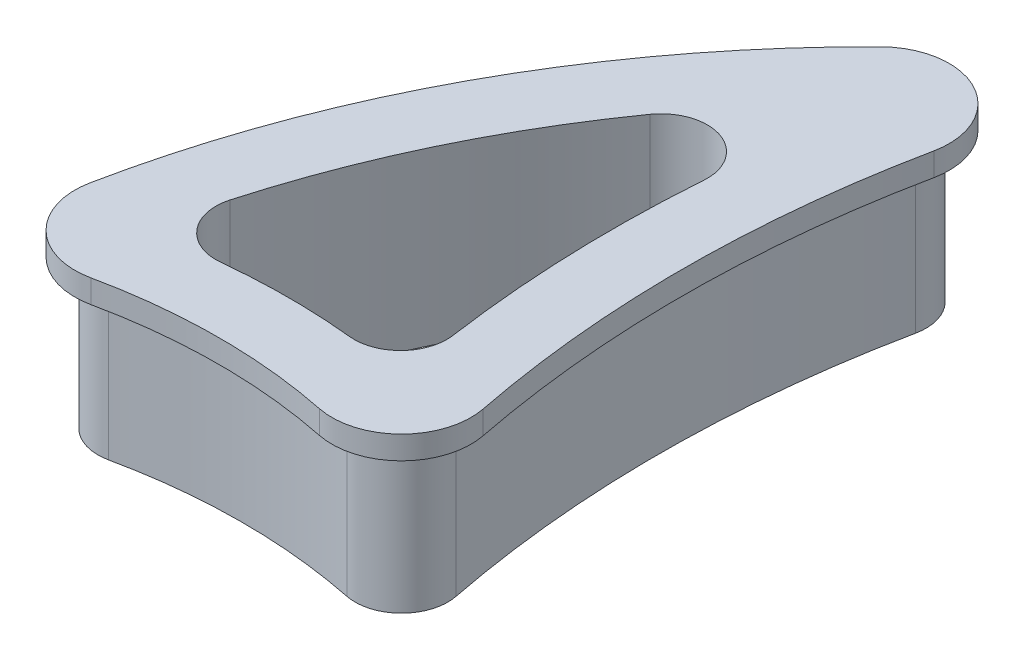
from build123d import *

# Parameters (mm, degrees)
EXTRUDE_1_DEPTH = 6.4
EXTRUDE_2_DEPTH = 1


with BuildPart() as part:
    # 草图1 → 凸台-拉伸1 (new body)
    with BuildSketch(Plane(origin=(0, 0, 0), x_dir=(1, 0, 0), z_dir=(0, 1, 0))):
        with BuildLine():
            ThreePointArc((2.829565104, -15.529906263), (1.88418981, -5.646325328), (2.910376158, 4.229192286))
            ThreePointArc((2.910376158, 4.229192286), (1.906294085, 6.389735523), (-0.452755984, 6.056552897))
            ThreePointArc((-0.452755984, 6.056552897), (-7.914394861, -3.882962322), (-12.140415639, -15.571023149))
            ThreePointArc((-12.140415639, -15.571023149), (-11.58539557, -17.387944), (-9.761966891, -17.92119489))
            ThreePointArc((-9.761966891, -17.92119489), (-4.64989516, -17.37013276), (0.466793237, -17.876538427))
            ThreePointArc((0.466793237, -17.876538427), (2.276755445, -17.336121852), (2.829565104, -15.529906263))
        make_face()
        with BuildLine():
            ThreePointArc((-3.602001562, -0.725023821), (-7.054850169, -6.602735021), (-9.459511378, -12.981391378))
            ThreePointArc((-9.459511378, -12.981391378), (-9.06507879, -14.812553198), (-7.328283633, -15.514175078))
            ThreePointArc((-7.328283633, -15.514175078), (-4.550929201, -15.369896432), (-1.773466789, -15.512081246))
            ThreePointArc((-1.773466789, -15.512081246), (-0.126352502, -14.908348224), (0.411230412, -13.238472884))
            ThreePointArc((0.411230412, -13.238472884), (-0.085305514, -7.64386169), (0.024455921, -2.028331904))
            ThreePointArc((0.024455921, -2.028331904), (-1.293712746, 0.000827838), (-3.602001562, -0.725023821))
        make_face(mode=Mode.SUBTRACT)
    extrude(amount=EXTRUDE_1_DEPTH)

    # 草图2 → 凸台-拉伸2 (add)
    with BuildSketch(Plane(origin=(0, 6.4, 0), x_dir=(1, 0, 0), z_dir=(0, 1, 0))):
        with BuildLine():
            ThreePointArc((3.889844067, 4.027592153), (2.884181446, -5.650415109), (3.810649235, -15.336324425))
            ThreePointArc((3.810649235, -15.336324425), (2.981434747, -18.045647807), (0.266491434, -18.85627267))
            ThreePointArc((0.266491434, -18.85627267), (-4.645529427, -18.370123231), (-9.553118288, -18.899142875))
            ThreePointArc((-9.553118288, -18.899142875), (-12.288261307, -18.09926654), (-13.120791411, -15.373885263))
            ThreePointArc((-13.120791411, -15.373885263), (-8.794151091, -3.407537273), (-1.154854145, 6.768633069))
            ThreePointArc((-1.154854145, 6.768633069), (2.383720959, 7.268407009), (3.889844067, 4.027592153))
        make_face()
        with BuildLine():
            ThreePointArc((0.024455921, -2.028331904), (-0.085305514, -7.64386169), (0.411230412, -13.238472884))
            ThreePointArc((0.411230412, -13.238472884), (-0.126352502, -14.908348224), (-1.773466789, -15.512081246))
            ThreePointArc((-1.773466789, -15.512081246), (-4.550929201, -15.369896432), (-7.328283633, -15.514175078))
            ThreePointArc((-7.328283633, -15.514175078), (-9.06507879, -14.812553198), (-9.459511378, -12.981391378))
            ThreePointArc((-9.459511378, -12.981391378), (-7.054850169, -6.602735021), (-3.602001562, -0.725023821))
            ThreePointArc((-3.602001562, -0.725023821), (-1.293712746, 0.000827838), (0.024455921, -2.028331904))
        make_face(mode=Mode.SUBTRACT)
    extrude(amount=EXTRUDE_2_DEPTH)


solid = part.part
